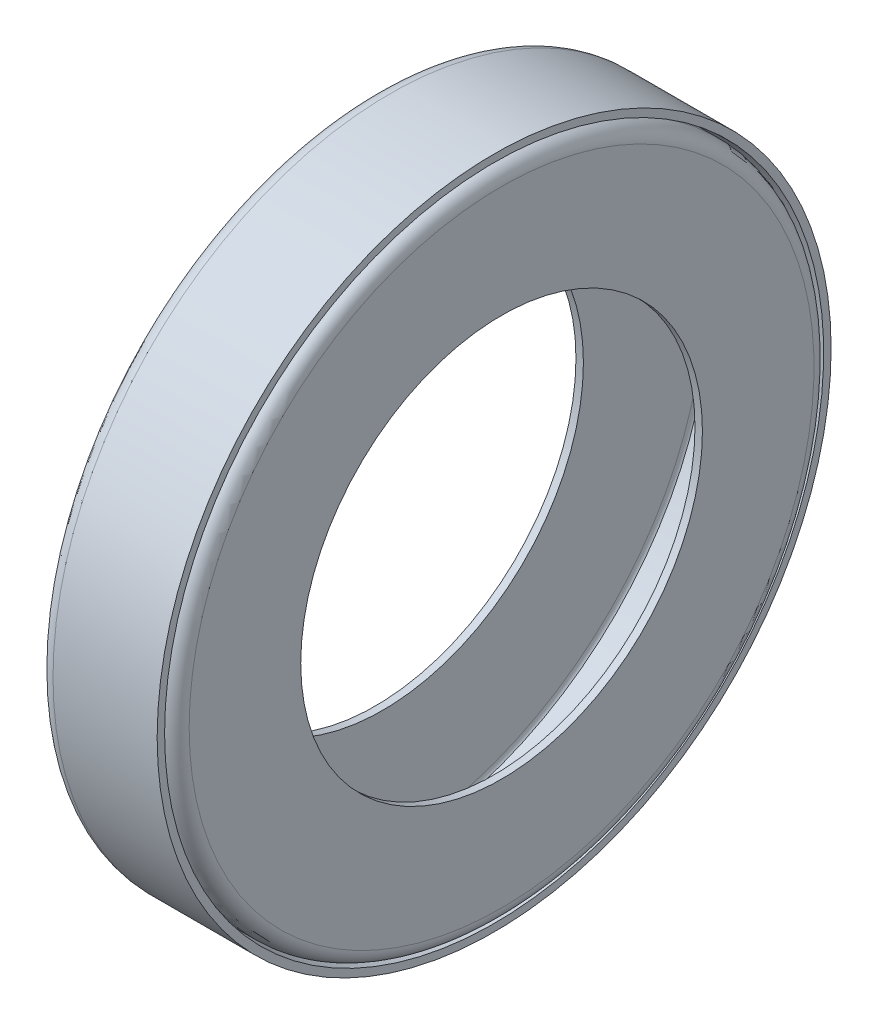
from build123d import *

# Parameters (mm, degrees)
FILLET1_R = 1
FILLET2_R = 1
FILLET3_R = 2
FILLET4_R = 2


with BuildPart() as part:
    # Sketch1 → Revolve1 (revolve)
    with BuildSketch(Plane.XY, mode=Mode.PRIVATE) as revolve1_sk:
        Polygon((0, 27), (0, 45.3), (16, 45.3), (16, 44.3), (1, 44.3), (1, 27), align=None)
        Polygon((17, 27), (17, 44), (2, 44), (2, 43), (16, 43), (16, 27), align=None)
    revolve(revolve1_sk.sketch.rotate(Axis((-12.255218601, 0, 0), (1, 0, 0)), 90), axis=Axis((-12.255218601, 0, 0), (1, 0, 0)))

    # Fillet1
    fillet1_edges = [part.edges().sort_by_distance(p)[0] for p in [
        (16, 0, -43),
    ]]
    fillet(fillet1_edges, radius=FILLET1_R)

    # Fillet2
    fillet2_edges = [part.edges().sort_by_distance(p)[0] for p in [
        (1, 0, -44.3),
    ]]
    fillet(fillet2_edges, radius=FILLET2_R)

    # Fillet3
    fillet3_edges = [part.edges().sort_by_distance(p)[0] for p in [
        (0, 0, -45.3),
    ]]
    fillet(fillet3_edges, radius=FILLET3_R)

    # Fillet4
    fillet4_edges = [part.edges().sort_by_distance(p)[0] for p in [
        (17, 0, -44),
    ]]
    fillet(fillet4_edges, radius=FILLET4_R)


solid = part.part
